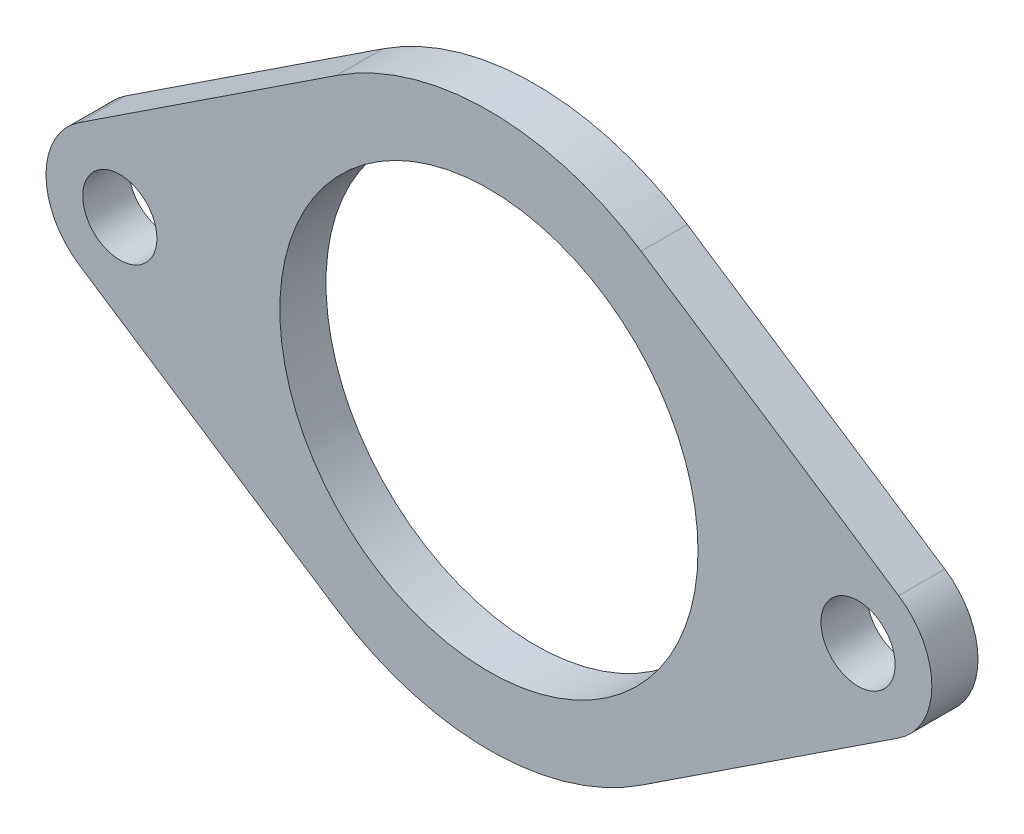
from build123d import *

# Parameters (mm, degrees)
SKETCH1_R           = 14.3891
SKETCH1_R_2         = 2.5527
BOSS_EXTRUDE1_DEPTH = 3.175


with BuildPart() as part:
    # Sketch1 → Boss-Extrude1 (new body)
    with BuildSketch(Plane.XY):
        with BuildLine():
            Line((-10.4775, 15.909886667), (-28.194, 4.242636444))
            ThreePointArc((-28.194, 4.242636444), (-30.48, 0), (-28.194, -4.242636444))
            Line((-28.194, -4.242636444), (-10.4775, -15.909886667))
            ThreePointArc((-10.4775, -15.909886667), (0, -19.05), (10.4775, -15.909886667))
            Line((10.4775, -15.909886667), (28.194, -4.242636444))
            ThreePointArc((28.194, -4.242636444), (30.48, 0), (28.194, 4.242636444))
            Line((28.194, 4.242636444), (10.4775, 15.909886667))
            ThreePointArc((10.4775, 15.909886667), (0, 19.05), (-10.4775, 15.909886667))
        make_face()
        Circle(SKETCH1_R, mode=Mode.SUBTRACT)
        with Locations((-25.4, 0)):
            Circle(SKETCH1_R_2, mode=Mode.SUBTRACT)
        with Locations((25.4, 0)):
            Circle(SKETCH1_R_2, mode=Mode.SUBTRACT)
    extrude(amount=BOSS_EXTRUDE1_DEPTH)


solid = part.part
